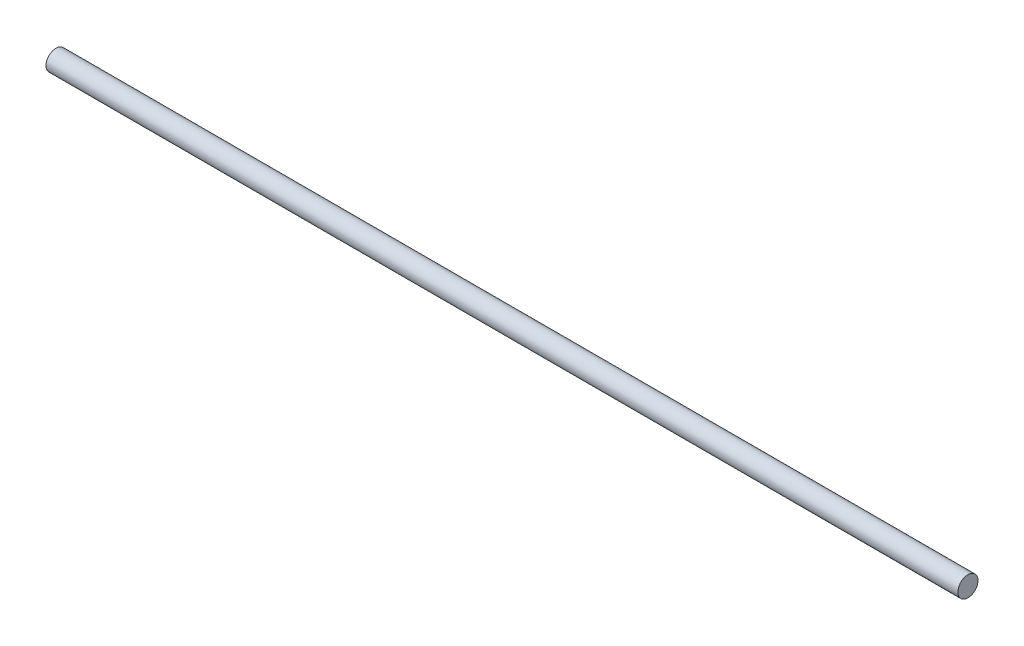
from build123d import *

# Parameters (mm, degrees)
SKETCH1_R           = 7.5
BOSS_EXTRUDE1_DEPTH = 680


with BuildPart() as part:
    # Sketch1 → Boss-Extrude1 (new body)
    with BuildSketch(Plane(origin=(0, 0, 0), x_dir=(0, 0, -1), z_dir=(1, 0, 0))):
        Circle(SKETCH1_R)
    extrude(amount=BOSS_EXTRUDE1_DEPTH)


solid = part.part
